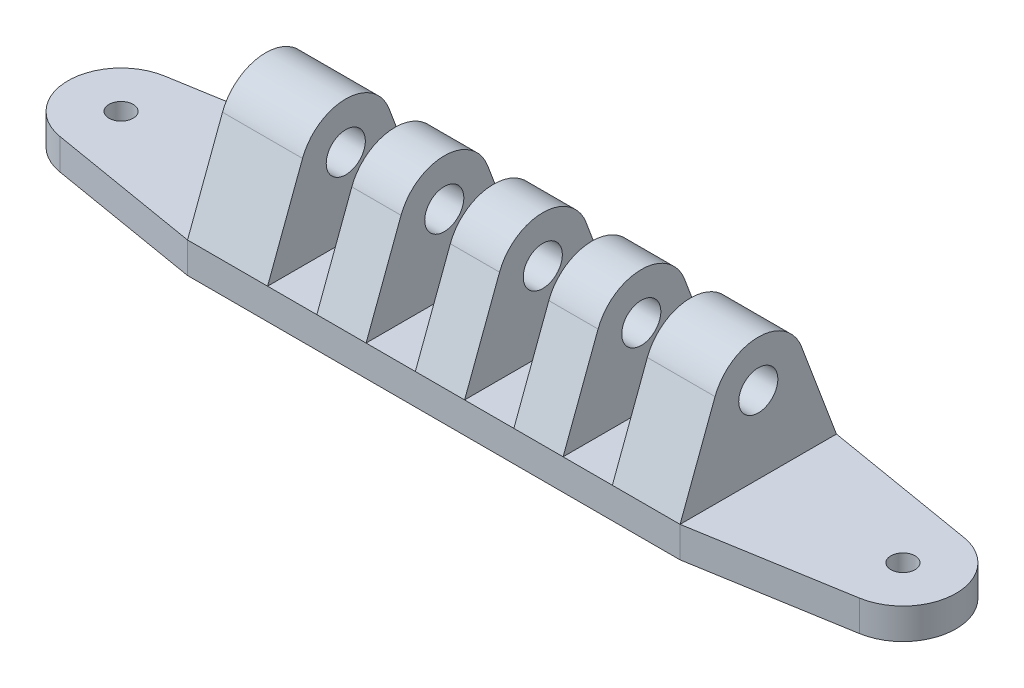
from build123d import *

# Parameters (mm, degrees)
SKETCH1_W           = 160
SKETCH1_H           = 50.8
BOSS_EXTRUDE1_DEPTH = 10
SKETCH2_R           = 6.35
BOSS_EXTRUDE2_DEPTH = 160
SKETCH3_W           = 16
SKETCH3_H           = 40
CUT_EXTRUDE1_DEPTH  = 71
SKETCH5_R           = 3.9243
BOSS_EXTRUDE3_DEPTH = 10


with BuildPart() as part:
    # Sketch1 → Boss-Extrude1 (new body)
    with BuildSketch(Plane(origin=(0, 0, 0), x_dir=(1, 0, 0), z_dir=(0, 1, 0))):
        with Locations((80, 25.4)):
            Rectangle(SKETCH1_W, SKETCH1_H)
    extrude(amount=BOSS_EXTRUDE1_DEPTH)

    # Sketch2 → Boss-Extrude2 (add, through all)
    with BuildSketch(Plane.ZY):
        with BuildLine():
            Line((-50.8, 10), (-39.444175854, 40.268882668))
            ThreePointArc((-39.444175854, 40.268882668), (-25.4, 50), (-11.355824146, 40.268882668))
            Line((-11.355824146, 40.268882668), (0, 10))
            Line((0, 10), (-50.8, 10))
        make_face()
        with Locations((-25.4, 35)):
            Circle(SKETCH2_R, mode=Mode.SUBTRACT)
    extrude(amount=-BOSS_EXTRUDE2_DEPTH)

    # Sketch3 → Cut-Extrude1 (cut)
    with BuildSketch(Plane(origin=(0, 0, -50.8), x_dir=(-1, 0, 0), z_dir=(0, 0, -1))):
        with Locations((-130, 30)):
            Rectangle(SKETCH3_W, SKETCH3_H)
        with Locations((-98, 30)):
            Rectangle(SKETCH3_W, SKETCH3_H)
        with Locations((-66, 30)):
            Rectangle(SKETCH3_W, SKETCH3_H)
        with Locations((-34, 30)):
            Rectangle(SKETCH3_W, SKETCH3_H)
    extrude(amount=-CUT_EXTRUDE1_DEPTH, mode=Mode.SUBTRACT)

    # Sketch5 → Boss-Extrude3 (add)
    # profile 1 of 2: a face of its own
    with BuildSketch(Plane.XZ):
        with BuildLine():
            Line((160, 0), (209.86380094, -8.4))
            ThreePointArc((209.86380094, -8.4), (224.239528875, -25.4), (209.86380094, -42.4))
            Line((209.86380094, -42.4), (160, -50.8))
            Line((160, -50.8), (160, 0))
        make_face()
        with Locations(Location((207, -25.4, 0), (0, 0, 90))):
            Circle(SKETCH5_R, mode=Mode.SUBTRACT)
    # profile 2 of 2: a face of its own
    with BuildSketch(Plane.XZ):
        with BuildLine():
            Line((0, 0), (-49.86380094, -8.4))
            ThreePointArc((-49.86380094, -8.4), (-64.239528875, -25.4), (-49.86380094, -42.4))
            Line((-49.86380094, -42.4), (0, -50.8))
            Line((0, -50.8), (0, 0))
        make_face()
        with Locations(Location((-47, -25.4, 0), (0, 0, 270))):
            Circle(SKETCH5_R, mode=Mode.SUBTRACT)
    extrude(amount=-BOSS_EXTRUDE3_DEPTH)


solid = part.part
